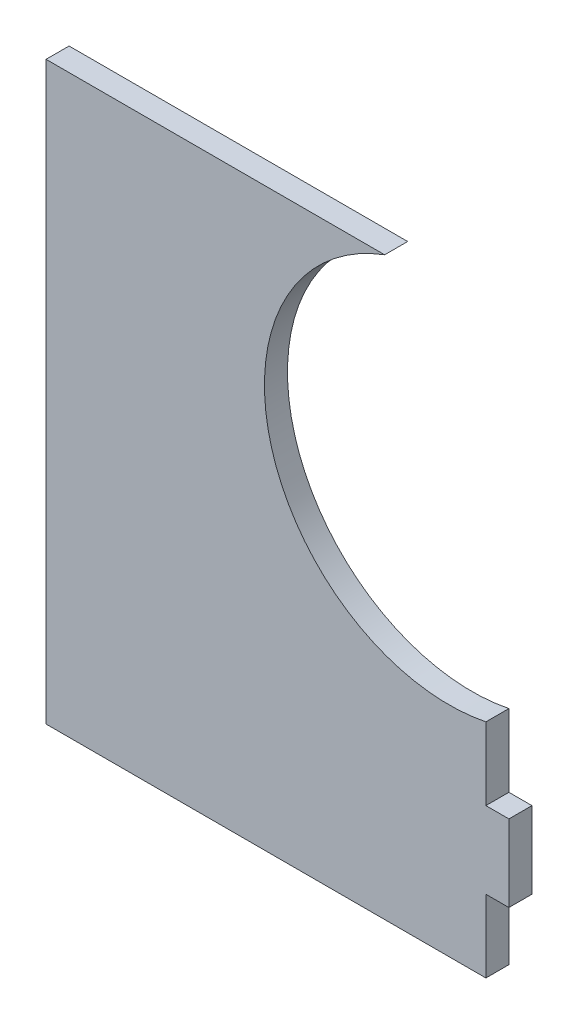
from build123d import *

# Parameters (mm, degrees)
SALIENTE_EXTRUIR1_DEPTH = 3


with BuildPart() as part:
    # Croquis1 → Saliente-Extruir1 (new body)
    with BuildSketch(Plane.XY):
        with BuildLine():
            Line((-3, 0.83840696), (-60.3, 0.83840696))
            Line((-60.3, 0.83840696), (-60.3, 75.83840696))
            Line((-60.3, 75.83840696), (-16.187910348, 75.83840696))
            ThreePointArc((-16.187910348, 75.83840696), (-30.919705343, 46.687711053), (-3, 29.73840696))
            Line((-3, 29.73840696), (-3, 20.28840696))
            Line((-3, 20.28840696), (0, 20.28840696))
            Line((0, 20.28840696), (0, 10.28840696))
            Line((0, 10.28840696), (-3, 10.28840696))
            Line((-3, 10.28840696), (-3, 0.83840696))
        make_face()
    extrude(amount=SALIENTE_EXTRUIR1_DEPTH)


solid = part.part
